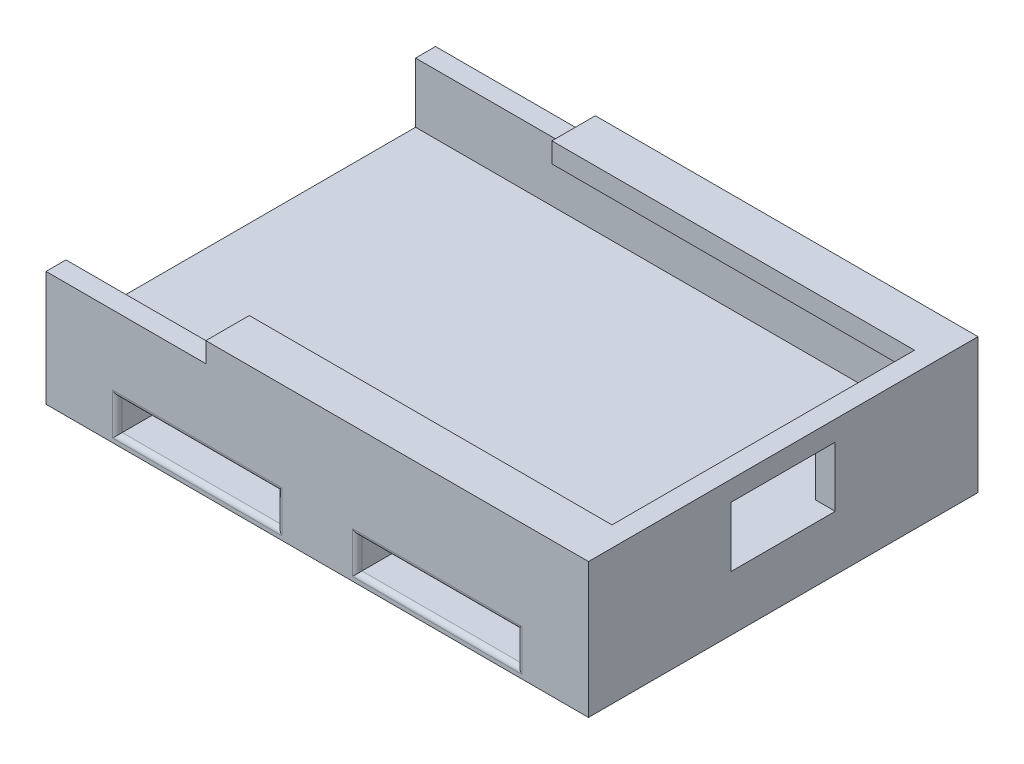
from build123d import *

# Parameters (mm, degrees)
BOSS_EXTRUDE1_DEPTH = 83.0326
SKETCH2_W           = 61.8998
SKETCH2_H           = 21.463
BOSS_EXTRUDE2_DEPTH = 3.175
SKETCH3_W           = 25.4
SKETCH3_H           = 5.08
CUT_EXTRUDE1_DEPTH  = 107.886039958
FILLET1_R           = 0.762
FILLET2_R           = 0.762
FILLET3_R           = 0.762
SKETCH5_W           = 16.529901782
SKETCH5_H           = 9.525
CUT_EXTRUDE2_DEPTH  = 90.51870739
SKETCH42_W          = 25.4
SKETCH42_H          = 6.9088
CUT_EXTRUDE3_DEPTH  = 3.175


with BuildPart() as part:
    # Sketch1 → Boss-Extrude1 (new body)
    with BuildSketch(Plane(origin=(0, 0, 0), x_dir=(0, 0, -1), z_dir=(1, 0, 0))):
        Polygon((-27.7749, 9.525), (-24.0411, 9.525), (-24.0411, 12.7), (-30.9499, 12.7), (-30.9499, -3.175), (-30.9499, -8.763), (30.9499, -8.763), (30.9499, -3.175), (30.9499, 12.7), (24.0411, 12.7), (24.0411, 9.525), (27.7749, 9.525), (27.7749, 0), (-27.7749, 0), align=None)
    extrude(amount=BOSS_EXTRUDE1_DEPTH)

    # Sketch2 → Boss-Extrude2 (add)
    with BuildSketch(Plane(origin=(83.0326, 0, 0), x_dir=(0, 0, -1), z_dir=(1, 0, 0))):
        with Locations((0, 1.9685)):
            Rectangle(SKETCH2_W, SKETCH2_H)
    extrude(amount=BOSS_EXTRUDE2_DEPTH)

    # Sketch3 → Cut-Extrude1 (cut, through all)
    with BuildSketch(Plane.XY.offset(30.9499)):
        with Locations((24.0538, -4.815937668)):
            Rectangle(SKETCH3_W, SKETCH3_H)
        with Locations((62.1538, -4.815937668)):
            Rectangle(SKETCH3_W, SKETCH3_H)
    extrude(amount=-CUT_EXTRUDE1_DEPTH, mode=Mode.SUBTRACT)

    # Fillet1
    fillet1_edges = [part.edges().sort_by_distance(p)[0] for p in [
        (24.0538, -7.355937668, -30.9499),
        (24.0538, -7.355937668, 30.9499),
        (62.1538, -7.355937668, -30.9499),
        (62.1538, -7.355937668, 30.9499),
    ]]
    fillet(fillet1_edges, radius=FILLET1_R)

    # Fillet2
    fillet2_edges = [part.edges().sort_by_distance(p)[0] for p in [
        (11.3538, -5.196937668, -30.9499),
        (24.0538, -2.275937668, -30.9499),
        (36.7538, -5.196937668, -30.9499),
        (49.4538, -5.196937668, -30.9499),
        (62.1538, -2.275937668, -30.9499),
        (74.8538, -5.196937668, -30.9499),
    ]]
    fillet(fillet2_edges, radius=FILLET2_R)

    # Fillet3
    fillet3_edges = [part.edges().sort_by_distance(p)[0] for p in [
        (74.8538, -5.196937668, 30.9499),
        (62.1538, -2.275937668, 30.9499),
        (49.4538, -5.196937668, 30.9499),
        (11.3538, -5.196937668, 30.9499),
        (24.0538, -2.275937668, 30.9499),
        (36.7538, -5.196937668, 30.9499),
    ]]
    fillet(fillet3_edges, radius=FILLET3_R)

    # Sketch5 → Cut-Extrude2 (cut, through all)
    with BuildSketch(Plane.ZY.offset(-83.0326)):
        with Locations((0, 4.7625)):
            Rectangle(SKETCH5_W, SKETCH5_H)
    extrude(amount=-CUT_EXTRUDE2_DEPTH, mode=Mode.SUBTRACT)

    # Sketch42 → Cut-Extrude3 (cut)
    with BuildSketch(Plane(origin=(0, 12.7, 0), x_dir=(1, 0, 0), z_dir=(0, 1, 0))):
        with Locations((12.7, 27.4955)):
            Rectangle(SKETCH42_W, SKETCH42_H)
        with Locations((12.7, -27.4955)):
            Rectangle(SKETCH42_W, SKETCH42_H)
    extrude(amount=-CUT_EXTRUDE3_DEPTH, mode=Mode.SUBTRACT)


solid = part.part
